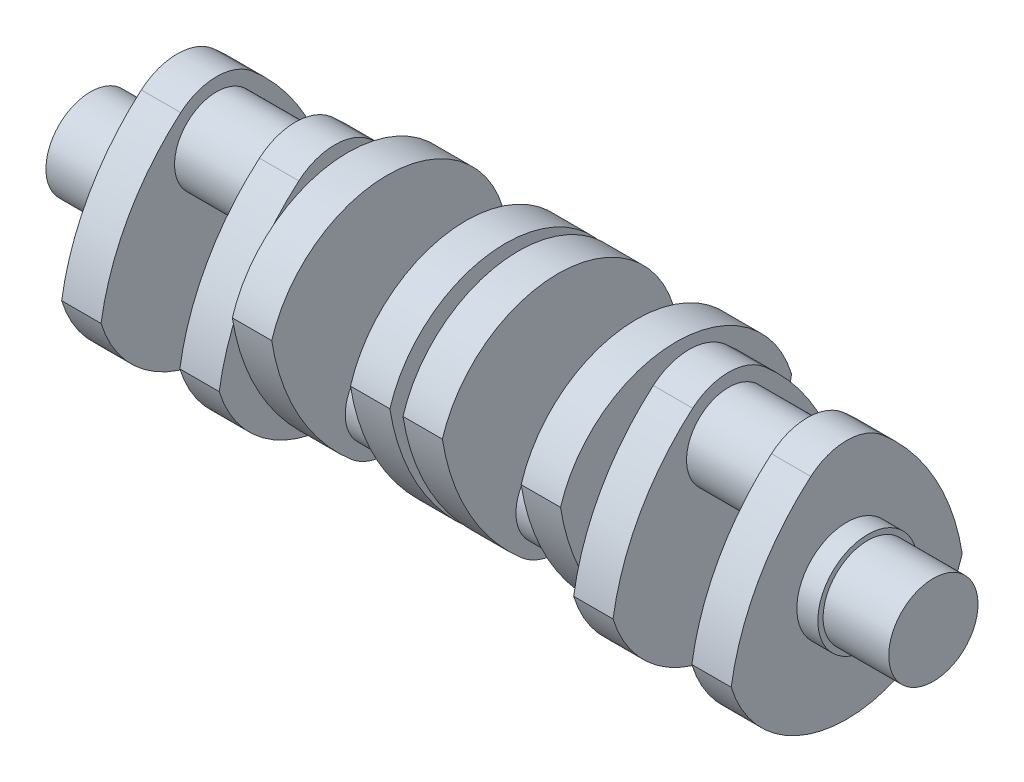
from build123d import *

# Parameters (mm, degrees)
SKETCH1_R           = 17
BOSS_EXTRUDE1_DEPTH = 25
SKETCH1_3_R         = 19
BOSS_EXTRUDE2_DEPTH = 8
BOSS_EXTRUDE3_DEPTH = 15
SKETCH4_R           = 16
BOSS_EXTRUDE4_DEPTH = 15
BOSS_EXTRUDE5_START = 5
SKETCH5_R           = 17
BOSS_EXTRUDE5_DEPTH = 5
BOSS_EXTRUDE6_DEPTH = 15
SKETCH7_R           = 16
BOSS_EXTRUDE7_DEPTH = 30
BOSS_EXTRUDE8_DEPTH = 15
BOSS_EXTRUDE9_START = 2.5
SKETCH9_R           = 17
BOSS_EXTRUDE9_DEPTH = 2.5


with BuildPart() as part:
    # Sketch1 → Boss-Extrude1 (new body)
    with BuildSketch(Plane(origin=(0, 0, 0), x_dir=(0, 0, -1), z_dir=(1, 0, 0))):
        Circle(SKETCH1_R)
    extrude(amount=-BOSS_EXTRUDE1_DEPTH)

    # Sketch1<3> → Boss-Extrude2 (add)
    with BuildSketch(Plane(origin=(0, 0, 0), x_dir=(0, 0, -1), z_dir=(1, 0, 0))):
        Circle(SKETCH1_3_R)
    extrude(amount=BOSS_EXTRUDE2_DEPTH)

    # Sketch2 → Boss-Extrude3 (add)
    with BuildSketch(Plane(origin=(8, 0, 0), x_dir=(0, 0, -1), z_dir=(1, 0, 0))):
        with BuildLine():
            ThreePointArc((-13.668094758, 40.943123461), (0, 46), (13.668094758, 40.943123461))
            ThreePointArc((13.668094758, 40.943123461), (33.683444249, 16.469257624), (44, -13.416407865))
            ThreePointArc((44, -13.416407865), (0, -46), (-44, -13.416407865))
            ThreePointArc((-44, -13.416407865), (-33.683444249, 16.469257624), (-13.668094758, 40.943123461))
        make_face()
    boss_extrude3 = extrude(amount=BOSS_EXTRUDE3_DEPTH)

    # Sketch4 → Boss-Extrude4 (add)
    with BuildSketch(Plane(origin=(23, 0, 0), x_dir=(0, 0, -1), z_dir=(1, 0, 0))):
        with Locations((0, 25)):
            Circle(SKETCH4_R)
    boss_extrude4 = extrude(amount=BOSS_EXTRUDE4_DEPTH)

    # Mirror1: Boss-Extrude3, Boss-Extrude4 across plane
    add(boss_extrude3.mirror(Plane(origin=(38, 25, 0), x_dir=(0, 0, 1), z_dir=(1, 0, 0))))
    add(boss_extrude4.mirror(Plane(origin=(38, 25, 0), x_dir=(0, 0, 1), z_dir=(1, 0, 0))))

    # Sketch5 → Boss-Extrude5 (add)
    with BuildSketch(Plane(origin=(68, 0, 0), x_dir=(0, 0, -1), z_dir=(1, 0, 0)).offset(BOSS_EXTRUDE5_START)):
        Circle(SKETCH5_R)
    extrude(amount=-BOSS_EXTRUDE5_DEPTH)

    # Sketch6 → Boss-Extrude6 (add)
    with BuildSketch(Plane(origin=(73, 0, 0), x_dir=(0, 0, -1), z_dir=(1, 0, 0))):
        with BuildLine():
            ThreePointArc((-13.668094758, -40.943123461), (0, -46), (13.668094758, -40.943123461))
            ThreePointArc((13.668094758, -40.943123461), (33.683444249, -16.469257624), (44, 13.416407865))
            ThreePointArc((44, 13.416407865), (0, 46), (-44, 13.416407865))
            ThreePointArc((-44, 13.416407865), (-33.683444249, -16.469257624), (-13.668094758, -40.943123461))
        make_face()
    extrude(amount=BOSS_EXTRUDE6_DEPTH)

    # Sketch7 → Boss-Extrude7 (add)
    with BuildSketch(Plane(origin=(88, 0, 0), x_dir=(0, 0, -1), z_dir=(1, 0, 0))):
        with Locations((0, -25)):
            Circle(SKETCH7_R)
    extrude(amount=BOSS_EXTRUDE7_DEPTH)

    # Sketch8 → Boss-Extrude8 (add)
    with BuildSketch(Plane(origin=(118, 0, 0), x_dir=(0, 0, -1), z_dir=(1, 0, 0))):
        with BuildLine():
            ThreePointArc((-13.668094758, -40.943123461), (0, -46), (13.668094758, -40.943123461))
            ThreePointArc((13.668094758, -40.943123461), (33.683444249, -16.469257624), (44, 13.416407865))
            ThreePointArc((44, 13.416407865), (0, 46), (-44, 13.416407865))
            ThreePointArc((-44, 13.416407865), (-33.683444249, -16.469257624), (-13.668094758, -40.943123461))
        make_face()
    extrude(amount=BOSS_EXTRUDE8_DEPTH)

    # Sketch9 → Boss-Extrude9 (add)
    with BuildSketch(Plane(origin=(133, 0, 0), x_dir=(0, 0, -1), z_dir=(1, 0, 0)).offset(BOSS_EXTRUDE9_START)):
        Circle(SKETCH9_R)
    extrude(amount=-BOSS_EXTRUDE9_DEPTH)

    # Mirror2: part across plane


with BuildPart() as part_1:
    add(part.part)
    add(part.part.mirror(Plane(origin=(135.5, 0, 0), x_dir=(0, 0, 1), z_dir=(1, 0, 0))))


solid = part_1.part
